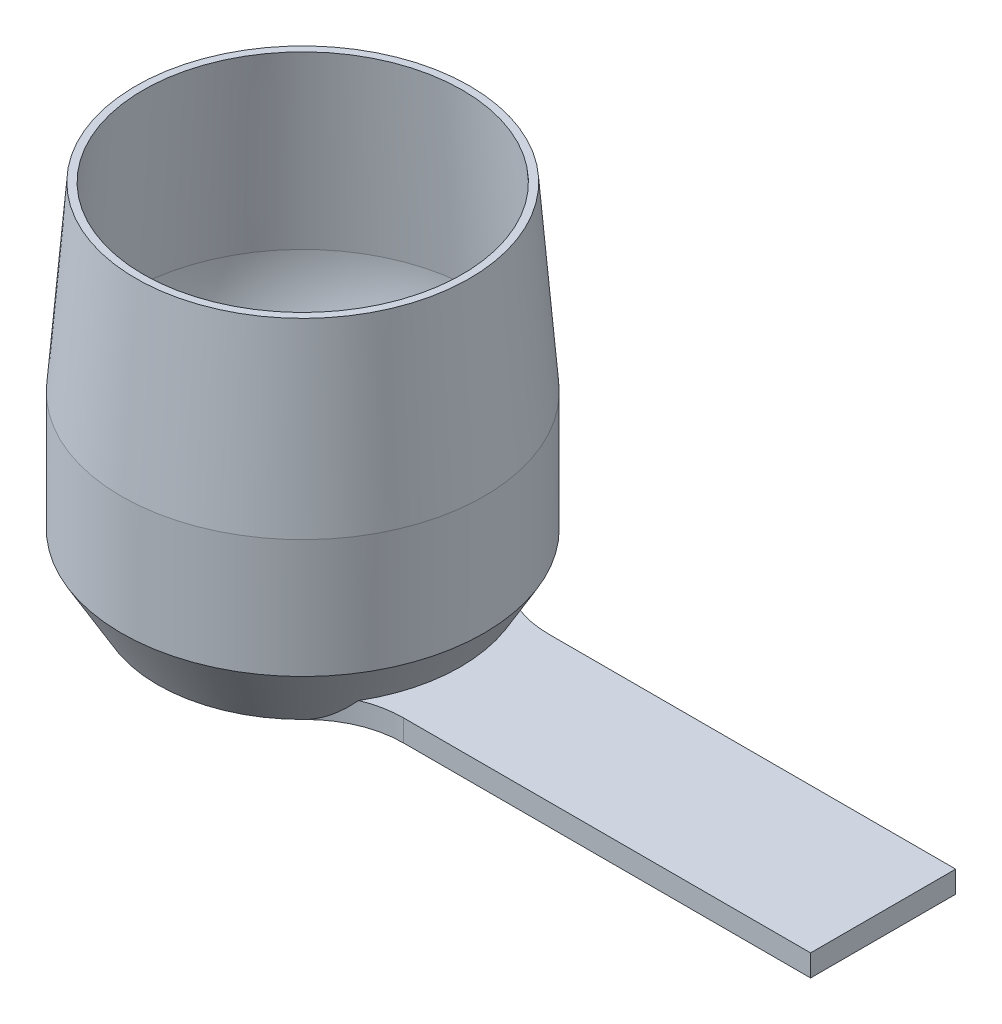
from build123d import *

# Parameters (mm, degrees)
BOSS_EXTRUDE2_DEPTH = 3


with BuildPart() as part:
    # Sketch6 → Revolve1 (revolve)
    with BuildSketch(Plane(origin=(0, 0, 0), x_dir=(0, 0, -1), z_dir=(1, 0, 0)), mode=Mode.PRIVATE) as revolve1_sk:
        with BuildLine():
            Line((0, 0), (-20, 0))
            Line((-20, 0), (-25, 8.660254038))
            Line((-25, 8.660254038), (-25, 25))
            Line((-25, 25), (-23, 50))
            Line((-23, 50), (-22, 50))
            Line((-22, 50), (-24, 25))
            ThreePointArc((-24, 25), (-17.041420129, 7.900244501), (0, 0.8))
            Line((0, 0.8), (0, 0))
        make_face()
    revolve(revolve1_sk.sketch.rotate(Axis((0, 0.628504357, 0), (0, 1, 0)), 180), axis=Axis((0, 0.628504357, 0), (0, 1, 0)))

    # Sketch7 → Boss-Extrude2 (add)
    with BuildSketch(Plane(origin=(0, 0, 0), x_dir=(1, 0, 0), z_dir=(0, 1, 0))):
        with BuildLine():
            Line((23.887428117, -10), (80, -10))
            Line((80, -10), (80, 10))
            Line((80, 10), (23.887428117, 10))
            ThreePointArc((23.887428117, 10), (18.662529879, 11.049522995), (14.248195421, 14.035274392))
            ThreePointArc((14.248195421, 14.035274392), (20, 0), (14.248195421, -14.035274392))
            ThreePointArc((14.248195421, -14.035274392), (18.662529879, -11.049522995), (23.887428117, -10))
        make_face()
    extrude(amount=BOSS_EXTRUDE2_DEPTH)


solid = part.part
